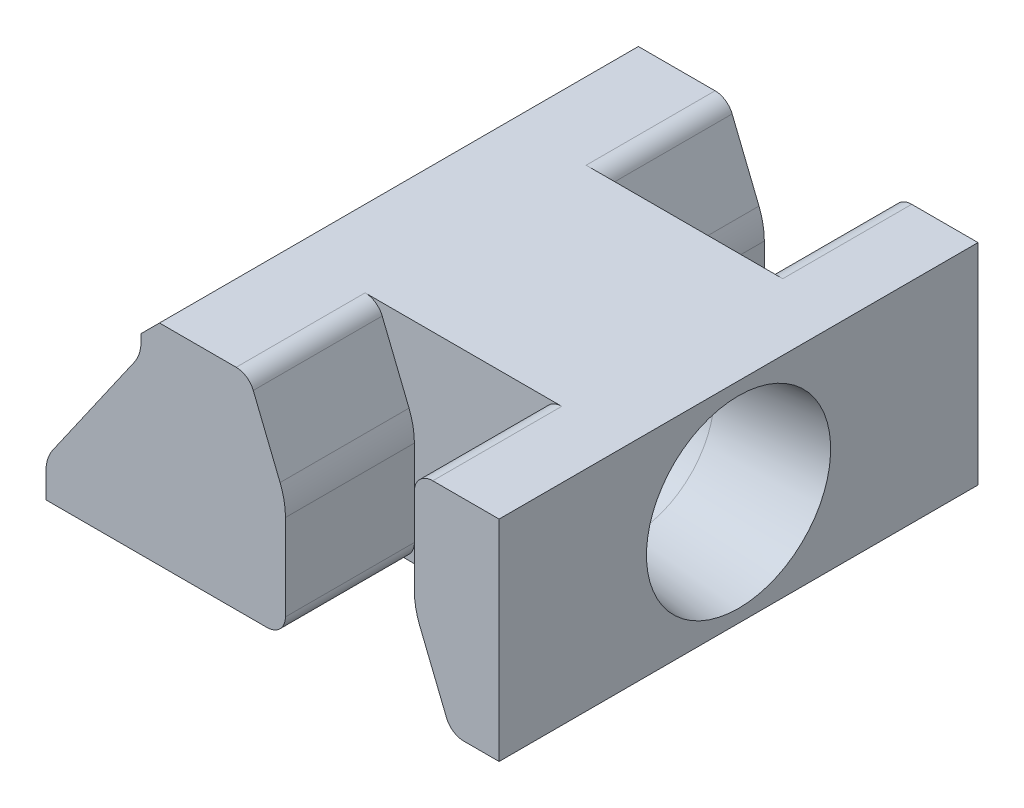
from build123d import *
from OCP.BRepFilletAPI import BRepFilletAPI_MakeChamfer

# Parameters (mm, degrees)
BOSS_EXTRUDE1_DEPTH = 13
CUT_EXTRUDE1_REACH  = 19.09
SKETCH2_W           = 3.5
SKETCH2_H           = 3.5
CHAMFER3_SIZE       = 1
CHAMFER3_SIZE2      = 2.475086853
SKETCH4_R           = 2.2
CUT_EXTRUDE3_DEPTH  = 9
FILLET1_R           = 1
CHAMFER4_SIZE       = 0.5
FILLET2_R           = 2
FILLET3_R           = 0.5
CHAMFER5_SIZE       = 0.3
CHAMFER5_SIZE2      = 2.854309336


with BuildPart() as part:
    # Sketch1 → Boss-Extrude1 (new body)
    with BuildSketch(Plane.XY):
        Polygon((-2.782258065, -2.595897682), (-0.20192428, 1.104102318), (-0.20192428, 2.104102318), (9.517741935, 2.104102318), (9.517741935, -3.595897682), (-2.782258065, -3.595897682), align=None)
    extrude(amount=BOSS_EXTRUDE1_DEPTH)

    # Sketch2 → Cut-Extrude1 (cut, up to next)
    with BuildSketch(Plane(origin=(0, 2.104102318, 0), x_dir=(1, 0, 0), z_dir=(0, 1, 0)), mode=Mode.PRIVATE) as cut_extrude1_sk1:
        with Locations((5.467741935, -1.75)):
            Rectangle(SKETCH2_W, SKETCH2_H)
    cut_extrude1_tool1 = extrude(cut_extrude1_sk1.sketch, amount=-CUT_EXTRUDE1_REACH, mode=Mode.PRIVATE) & part.part
    # Sketch2 → Cut-Extrude1 (cut, up to next)
    with BuildSketch(Plane(origin=(0, 2.104102318, 0), x_dir=(1, 0, 0), z_dir=(0, 1, 0)), mode=Mode.PRIVATE) as cut_extrude1_sk2:
        with Locations((5.467741935, -11.25)):
            Rectangle(SKETCH2_W, SKETCH2_H)
    cut_extrude1_tool2 = extrude(cut_extrude1_sk2.sketch, amount=-CUT_EXTRUDE1_REACH, mode=Mode.PRIVATE) & part.part
    add(cut_extrude1_tool1.solids().sort_by_distance((5.467742, 2.104102, 1.75))[0], mode=Mode.SUBTRACT)
    add(cut_extrude1_tool2.solids().sort_by_distance((5.467742, 2.104102, 11.25))[0], mode=Mode.SUBTRACT)

    # Chamfer3: one chamfer whose edges measure the first distance from different faces: ONE call of the kernel's chamfer builder (chamfer() names one face for all edges)
    chamfer3_edges_1 = [part.edges().sort_by_distance(p)[0] for p in [
        (3.717741935, 2.104102318, 1.75),
        (3.717741935, 2.104102318, 11.25),
    ]]
    chamfer3_side_1 = [part.faces().sort_by_distance(p)[0] for p in [
        (4.46311444, 2.104102318, 6.5),
    ]]
    chamfer3_edges_2 = [part.edges().sort_by_distance(p)[0] for p in [
        (7.217741935, -3.595897682, 1.75),
        (7.217741935, -3.595897682, 11.25),
    ]]
    chamfer3_side_2 = [part.faces().sort_by_distance(p)[0] for p in [
        (2.987756707, -3.595897682, 6.5),
    ]]
    chamfer3 = BRepFilletAPI_MakeChamfer(part.part.solid().wrapped)
    for e in chamfer3_edges_1:
        chamfer3.Add(CHAMFER3_SIZE, CHAMFER3_SIZE2, e.wrapped, chamfer3_side_1[0].wrapped)  # the first distance lies on this face
    for e in chamfer3_edges_2:
        chamfer3.Add(CHAMFER3_SIZE, CHAMFER3_SIZE2, e.wrapped, chamfer3_side_2[0].wrapped)  # the first distance lies on this face
    add(Compound.cast(chamfer3.Shape()), mode=Mode.REPLACE)

    # Sketch4 → Cut-Extrude3 (cut)
    with BuildSketch(Plane(origin=(9.517741935, 0, 0), x_dir=(0, 0, -1), z_dir=(1, 0, 0))):
        with Locations(Location((-6.5, -0.745897682, 0), (0, 0, 90))):
            Circle(SKETCH4_R)
    extrude(amount=-CUT_EXTRUDE3_DEPTH, mode=Mode.SUBTRACT)

    # Fillet1
    fillet1_edges = [part.edges().sort_by_distance(p)[0] for p in [
        (-2.782258065, -2.595897682, 6.5),
        (-0.20192428, 1.104102318, 6.5),
    ]]
    fillet(fillet1_edges, radius=FILLET1_R)

    # Chamfer4
    chamfer4_edges = [part.edges().sort_by_distance(p)[0] for p in [
        (-0.20192428, 2.104102318, 6.5),
    ]]
    chamfer(chamfer4_edges, length=CHAMFER4_SIZE)

    # Fillet2
    fillet2_edges = [part.edges().sort_by_distance(p)[0] for p in [
        (3.717741935, -0.370984535, 11.25),
        (7.217741935, -1.120810828, 11.25),
        (7.217741935, -1.120810828, 1.75),
        (3.717741935, -0.370984535, 1.75),
    ]]
    fillet(fillet2_edges, radius=FILLET2_R)

    # Fillet3
    fillet3_edges = [part.edges().sort_by_distance(p)[0] for p in [
        (7.217741935, 2.104102318, 1.75),
        (3.717741935, -3.595897682, 1.75),
        (7.217741935, 2.104102318, 11.25),
        (3.717741935, -3.595897682, 11.25),
        (2.717741935, 2.104102318, 1.75),
        (2.717741935, 2.104102318, 11.25),
        (8.217741935, -3.595897682, 1.75),
        (8.217741935, -3.595897682, 11.25),
    ]]
    fillet(fillet3_edges, radius=FILLET3_R)

    # Chamfer5
    chamfer5_edges = [part.edges().sort_by_distance(p)[0] for p in [
        (9.517741935, -2.945897682, 6.5),
    ]]
    chamfer5_side = [part.faces().sort_by_distance(p)[0] for p in [
        (9.517741935, 1.962155145, 6.5),
    ]]
    chamfer(chamfer5_edges, length=CHAMFER5_SIZE, length2=CHAMFER5_SIZE2, reference=chamfer5_side[0])


solid = part.part
